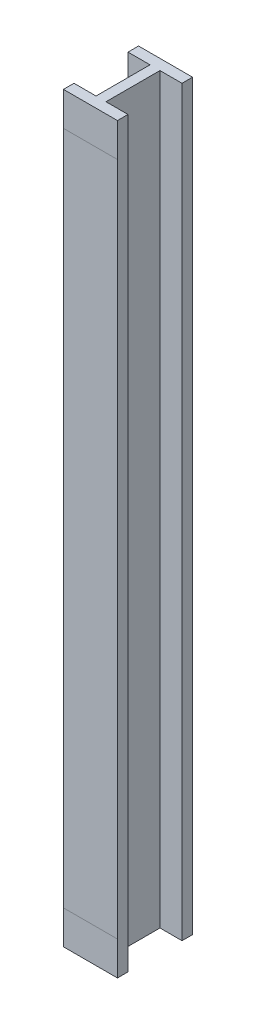
from build123d import *

# Parameters (mm, degrees)
DODANIE_WYCI_GNI_CIE1_DEPTH = 2200


with BuildPart() as part:
    # Szkic1 → Dodanie-wyciągnięcie1 (new body)
    with BuildSketch(Plane(origin=(0, 0, 0), x_dir=(1, 0, 0), z_dir=(0, 1, 0))):
        Polygon((0, 0), (80, 0), (80, 31.25), (14.748603352, 31.25), (14.748603352, 191.25), (80, 191.25), (80, 222.5), (-80, 222.5), (-80, 191.25), (-14.748603352, 191.25), (-14.748603352, 31.25), (-80, 31.25), (-80, 0), align=None)
    extrude(amount=DODANIE_WYCI_GNI_CIE1_DEPTH)


solid = part.part
